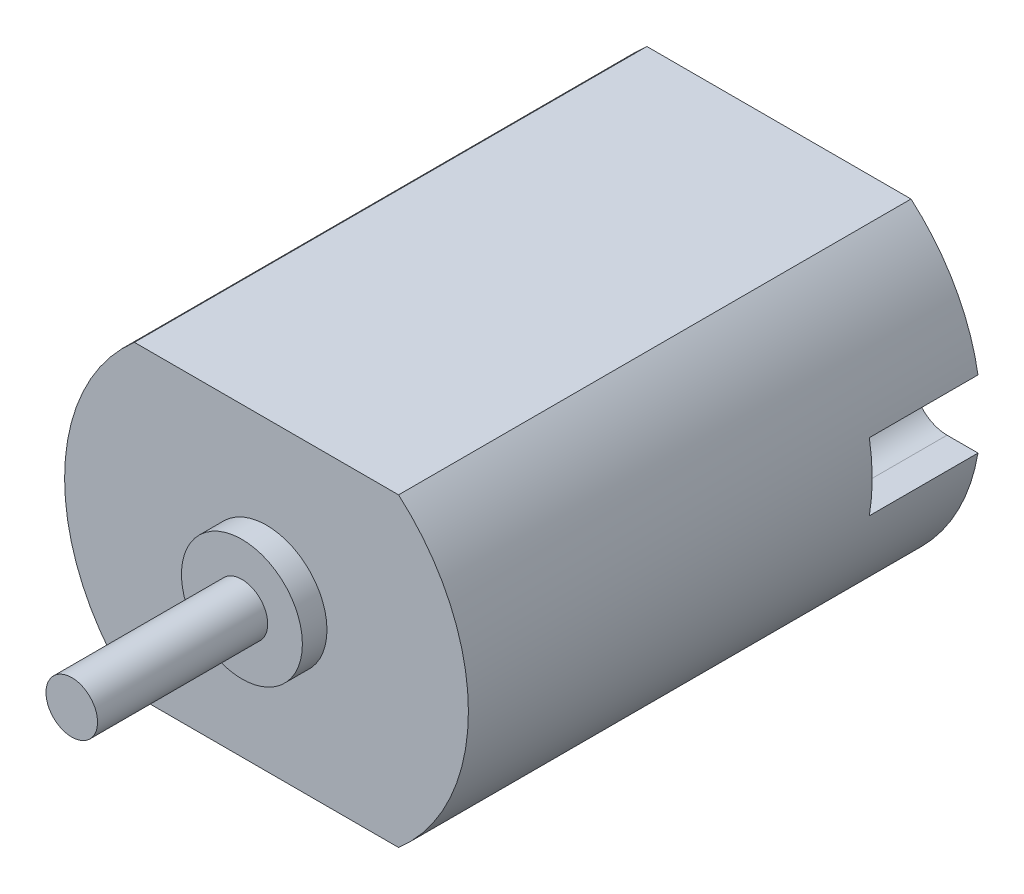
from build123d import *

# Parameters (mm, degrees)
SALIENTE_EXTRUIR1_DEPTH = 25
CROQUIS2_R              = 2.95
SALIENTE_EXTRUIR2_DEPTH = 1.2
CORTAR_EXTRUIR1_DEPTH   = 5.3
SALIENTE_EXTRUIR3_DEPTH = 2.4
CORTAR_EXTRUIR2_DEPTH   = 2.5
CROQUIS6_R              = 1.256804149
SALIENTE_EXTRUIR4_DEPTH = 1.1
CROQUIS7_R              = 1.257398905
SALIENTE_EXTRUIR5_DEPTH = 38


with BuildPart() as part:
    # Croquis1 → Saliente-Extruir1 (new body)
    with BuildSketch(Plane.XY):
        with BuildLine():
            Line((6.443601477, 7.45), (0, 7.45))
            Line((0, 7.45), (-6.443601477, 7.45))
            ThreePointArc((-6.443601477, 7.45), (-9.85, 0), (-6.443601477, -7.45))
            Line((-6.443601477, -7.45), (0, -7.45))
            Line((0, -7.45), (6.443601477, -7.45))
            ThreePointArc((6.443601477, -7.45), (9.85, 0), (6.443601477, 7.45))
        make_face()
    extrude(amount=SALIENTE_EXTRUIR1_DEPTH)

    # Croquis2 → Saliente-Extruir2 (add)
    with BuildSketch(Plane.XY.offset(25)):
        Circle(CROQUIS2_R)
    extrude(amount=SALIENTE_EXTRUIR2_DEPTH)

    # Croquis3 → Cortar-Extruir1 (cut)
    with BuildSketch(Plane(origin=(0, 0, 0), x_dir=(-1, 0, 0), z_dir=(0, 0, -1))):
        with BuildLine():
            Line((-8.2, 1.65), (-9.710818709, 1.65))
            ThreePointArc((-9.710818709, 1.65), (-9.85, 0), (-9.710818709, -1.65))
            Line((-9.710818709, -1.65), (-8.2, -1.65))
            ThreePointArc((-8.2, -1.65), (-6.55, 0), (-8.2, 1.65))
        make_face()
        with BuildLine():
            Line((9.710818709, 1.65), (8.2, 1.65))
            ThreePointArc((8.2, 1.65), (6.55, 0), (8.2, -1.65))
            Line((8.2, -1.65), (9.710818709, -1.65))
            ThreePointArc((9.710818709, -1.65), (9.85, 0), (9.710818709, 1.65))
        make_face()
    extrude(amount=-CORTAR_EXTRUIR1_DEPTH, mode=Mode.SUBTRACT)

    # Croquis4 → Saliente-Extruir3 (add)
    with BuildSketch(Plane(origin=(0, 0, 0), x_dir=(-1, 0, 0), z_dir=(0, 0, -1))):
        with BuildLine():
            Line((3.874274126, 3), (0, 3))
            Line((0, 3), (-3.874274126, 3))
            ThreePointArc((-3.874274126, 3), (0, -4.9), (3.874274126, 3))
        make_face()
    extrude(amount=SALIENTE_EXTRUIR3_DEPTH)

    # Croquis5 → Cortar-Extruir2 (cut)
    with BuildSketch(Plane(origin=(0, 0, -2.4), x_dir=(-1, 0, 0), z_dir=(0, 0, -1))):
        Polygon((0, -3), (-3, -3), (-3, -1.8), (3, -1.8), (3, -3), align=None)
    extrude(amount=-CORTAR_EXTRUIR2_DEPTH, mode=Mode.SUBTRACT)



with BuildPart() as body_2:
    # Croquis6 → Saliente-Extruir4 (new body)
    with BuildSketch(Plane(origin=(0, 0, -2.4), x_dir=(-1, 0, 0), z_dir=(0, 0, -1))):
        Circle(CROQUIS6_R)
    extrude(amount=SALIENTE_EXTRUIR4_DEPTH)


with BuildPart() as part_1:
    add(part.part)

    add(body_2.part)  # Saliente-Extruir5 merges body 2
    # Croquis7 → Saliente-Extruir5 (add)
    with BuildSketch(Plane(origin=(0, 0, -3.5), x_dir=(-1, 0, 0), z_dir=(0, 0, -1))):
        Circle(CROQUIS7_R)
    extrude(amount=-SALIENTE_EXTRUIR5_DEPTH)


solid = part_1.part
